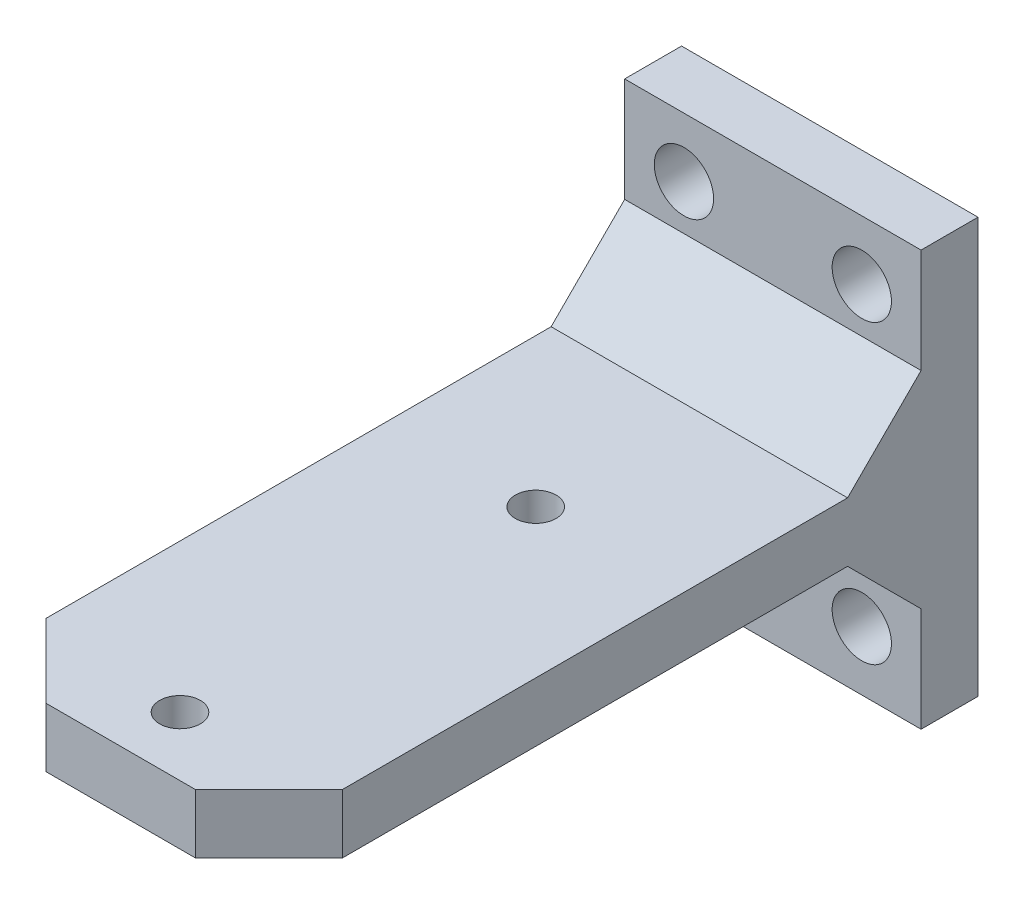
from build123d import *

# Parameters (mm, degrees)
BOSS_EXTRUDE1_DEPTH = 31.75
SKETCH2_R           = 3.175
CUT_EXTRUDE1_DEPTH  = 19.05
CHAMFER1_SIZE       = 7.874
SKETCH3_R           = 2.1828125
CUT_EXTRUDE2_DEPTH  = 19.05
CHAMFER2_SIZE       = 7.874
CHAMFER3_SIZE       = 0.254


with BuildPart() as part:
    # Sketch1 → Boss-Extrude1 (new body)
    with BuildSketch(Plane(origin=(0, 0, 0), x_dir=(0, 0, -1), z_dir=(1, 0, 0))):
        Polygon((0, 0), (0, 44.45), (-6.35, 44.45), (-6.35, 25.4), (-76.2, 25.4), (-76.2, 19.05), (-6.35, 19.05), (-6.35, 0), align=None)
    extrude(amount=BOSS_EXTRUDE1_DEPTH)

    # Sketch2 → Cut-Extrude1 (cut)
    with BuildSketch(Plane.XY.offset(6.35)):
        with Locations((6.35, 38.1)):
            Circle(SKETCH2_R)
        with Locations((25.4, 38.1)):
            Circle(SKETCH2_R)
        with Locations((6.35, 6.35)):
            Circle(SKETCH2_R)
        with Locations((25.4, 6.35)):
            Circle(SKETCH2_R)
    extrude(amount=-CUT_EXTRUDE1_DEPTH, mode=Mode.SUBTRACT)

    # Chamfer1
    chamfer1_edges = [part.edges().sort_by_distance(p)[0] for p in [
        (15.875, 19.05, 6.35),
        (15.875, 25.4, 6.35),
    ]]
    chamfer(chamfer1_edges, length=CHAMFER1_SIZE)

    # Sketch3 → Cut-Extrude2 (cut)
    with BuildSketch(Plane(origin=(0, 25.4, 0), x_dir=(1, 0, 0), z_dir=(0, 1, 0))):
        with Locations(Location((15.875, -69.85, 0), (0, 0, 270))):
            Circle(SKETCH3_R)
        with Locations(Location((15.875, -31.75, 0), (0, 0, 270))):
            Circle(SKETCH3_R)
    extrude(amount=-CUT_EXTRUDE2_DEPTH, mode=Mode.SUBTRACT)

    # Chamfer2
    chamfer2_edges = [part.edges().sort_by_distance(p)[0] for p in [
        (31.75, 22.225, 76.2),
        (0, 22.225, 76.2),
    ]]
    chamfer(chamfer2_edges, length=CHAMFER2_SIZE)

    # Chamfer3
    chamfer3_edges = [part.edges().sort_by_distance(p)[0] for p in [
        (0, 22.225, 0),
        (15.875, 44.45, 0),
        (15.875, 0, 0),
        (22.225, 38.1, 0),
        (3.175, 6.35, 0),
        (22.225, 6.35, 0),
        (3.175, 38.1, 0),
        (31.75, 22.225, 0),
    ]]
    chamfer(chamfer3_edges, length=CHAMFER3_SIZE)


solid = part.part
